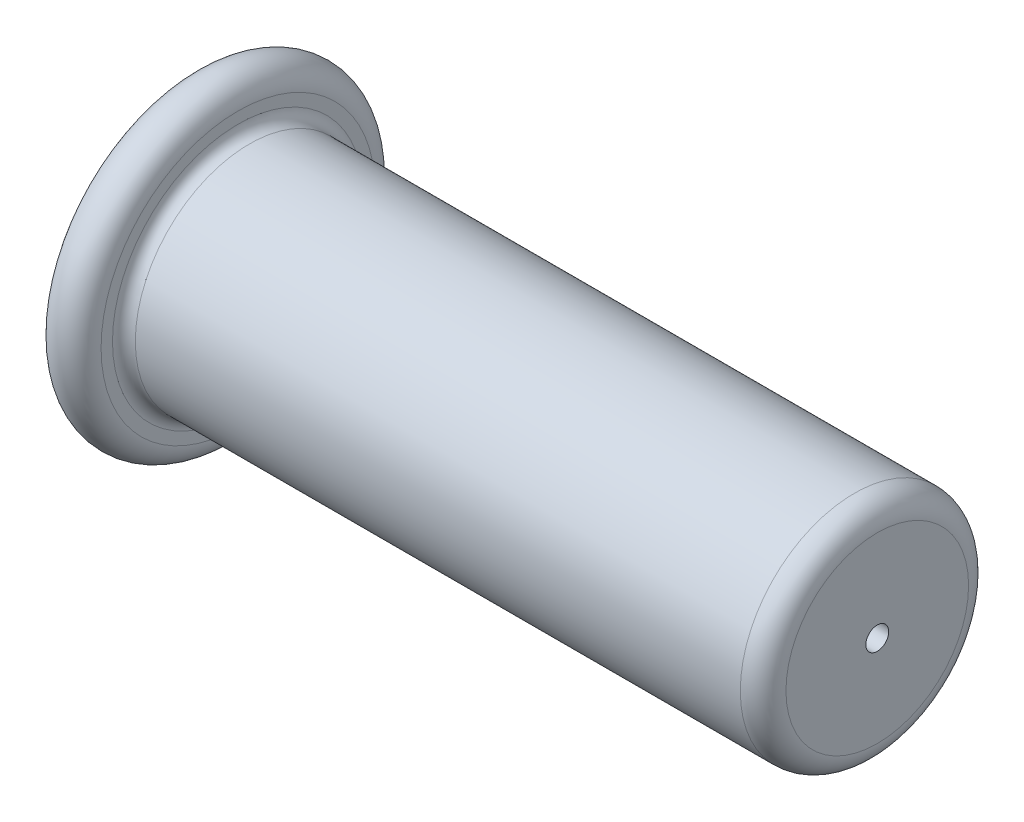
from build123d import *


with BuildPart() as part:
    # 草图1 → 旋转1 (revolve)
    with BuildSketch(Plane.XY, mode=Mode.PRIVATE) as revolve_1_sk:
        with BuildLine():
            Line((0, 13), (0, 24))
            ThreePointArc((0, 24), (4, 28), (8, 24))
            Line((8, 24), (8, 22))
            ThreePointArc((8, 22), (8.585786438, 20.585786438), (10, 20))
            Line((10, 20), (116, 20))
            ThreePointArc((116, 20), (118.828427125, 18.828427125), (120, 16))
            Line((120, 16), (120, 2))
            Line((120, 2), (117, 2))
            Line((117, 2), (60, 2))
            Line((60, 2), (60, 12))
            Line((60, 12), (1, 12))
            Line((1, 12), (0, 13))
        make_face()
    revolve(revolve_1_sk.sketch.rotate(Axis((0, 0, 0), (1, 0, 0)), 90), axis=Axis((0, 0, 0), (1, 0, 0)))


solid = part.part
